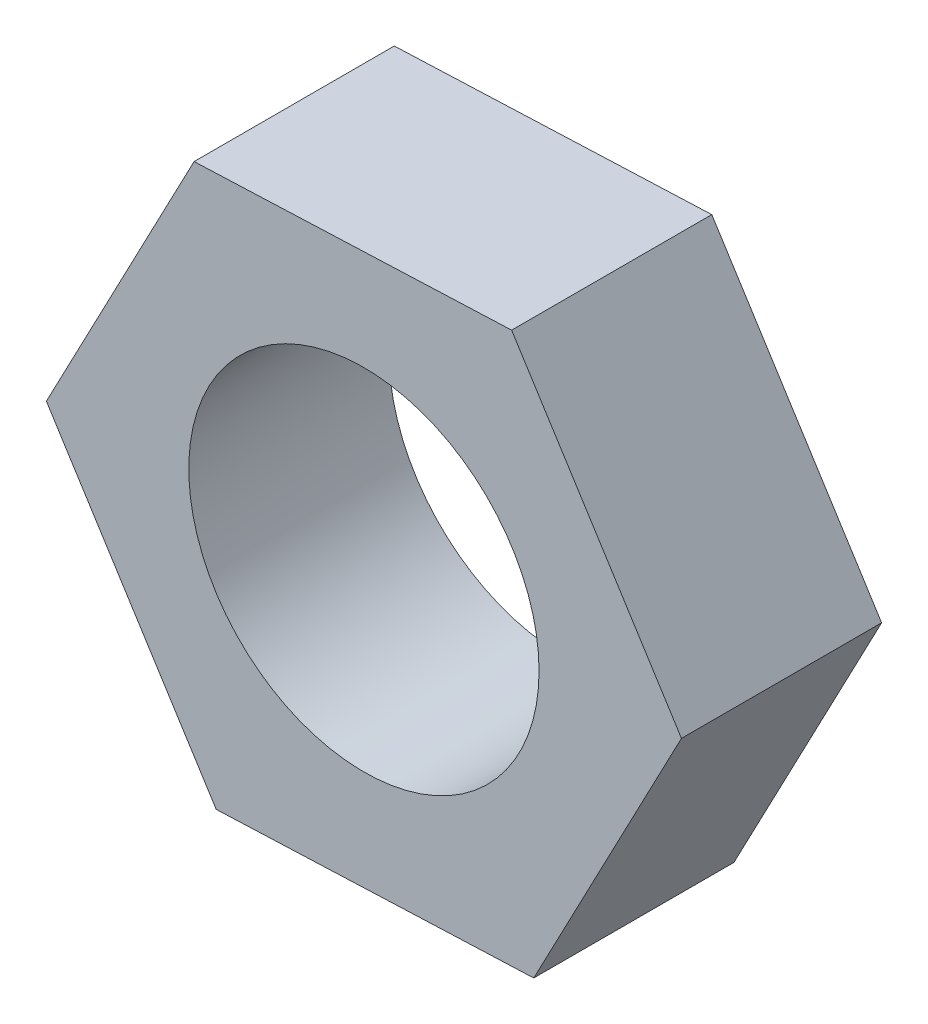
from build123d import *

# Parameters (mm, degrees)
SKETCH1_R           = 3.5
BOSS_EXTRUDE1_DEPTH = 4


with BuildPart() as part:
    # Sketch1 → Boss-Extrude1 (new body)
    with BuildSketch(Plane.XY):
        Polygon((3.393962947, -5.367899854), (6.345719112, 0.255308205), (2.951756165, 5.623208059), (-3.393962947, 5.367899854), (-6.345719112, -0.255308205), (-2.951756165, -5.623208059), align=None)
        Circle(SKETCH1_R, mode=Mode.SUBTRACT)
    extrude(amount=BOSS_EXTRUDE1_DEPTH)


solid = part.part
